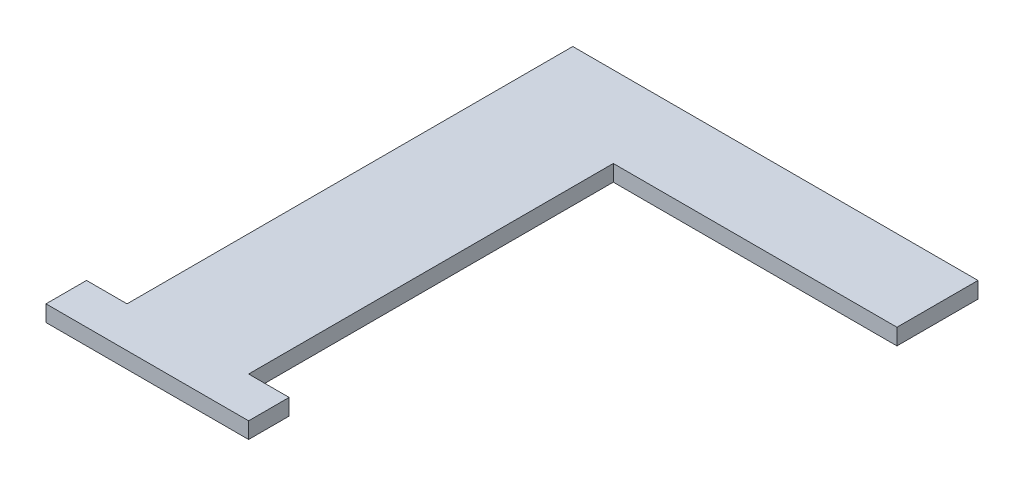
from build123d import *

# Parameters (mm, degrees)
BOSS_EXTRUDE1_DEPTH = 2


with BuildPart() as part:
    # Sketch2 → Boss-Extrude1 (new body)
    with BuildSketch(Plane(origin=(0, 0, 0), x_dir=(1, 0, 0), z_dir=(0, 1, 0))):
        Polygon((0, 0), (-50, 0), (-50, -55), (-55, -55), (-55, -60), (-50, -60), (-35, -60), (-30, -60), (-30, -55), (-35, -55), (-35, -10), (0, -10), align=None)
    extrude(amount=BOSS_EXTRUDE1_DEPTH)


solid = part.part
